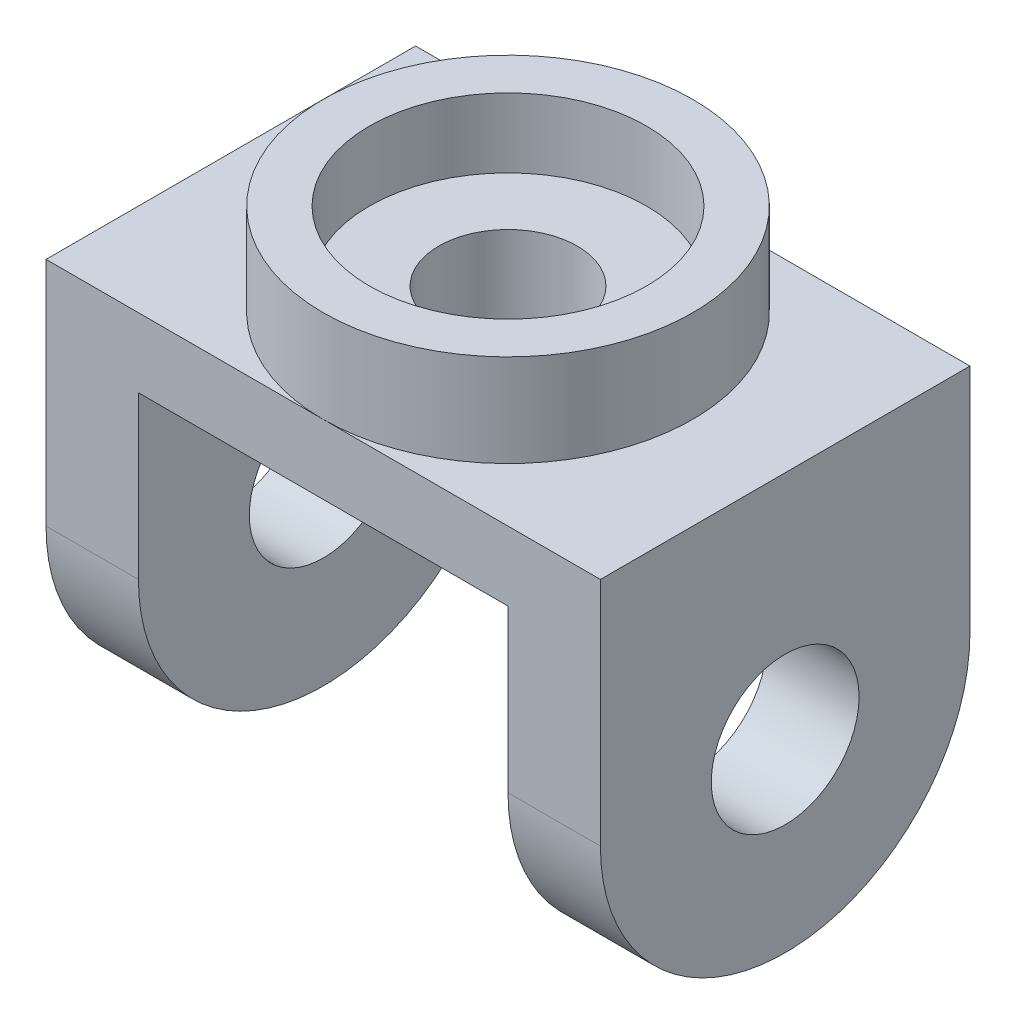
from build123d import *

# Parameters (mm, degrees)
SKETCH1_W           = 120
SKETCH1_H           = 80
BOSS_EXTRUDE1_DEPTH = 15
SKETCH2_R           = 40
BOSS_EXTRUDE2_DEPTH = 20
SKETCH4_R           = 30
CUT_EXTRUDE1_DEPTH  = 15
SKETCH5_R           = 15
CUT_EXTRUDE2_DEPTH  = 42
SKETCH7_W           = 80
SKETCH7_H           = 35
BOSS_EXTRUDE3_DEPTH = 20
BOSS_EXTRUDE4_START = -20
SKETCH8_W           = 80
SKETCH8_H           = 35
BOSS_EXTRUDE4_DEPTH = 20
SKETCH9_R           = 16
CUT_EXTRUDE3_DEPTH  = 139


with BuildPart() as part:
    # Sketch1 → Boss-Extrude1 (new body)
    with BuildSketch(Plane(origin=(0, 0, 0), x_dir=(1, 0, 0), z_dir=(0, 1, 0))):
        Rectangle(SKETCH1_W, SKETCH1_H)
    extrude(amount=-BOSS_EXTRUDE1_DEPTH)

    # Sketch2 → Boss-Extrude2 (add)
    with BuildSketch(Plane(origin=(0, 0, 0), x_dir=(1, 0, 0), z_dir=(0, 1, 0))):
        with Locations(Location((0, 0, 0), (0, 0, 270))):
            Circle(SKETCH2_R)
    extrude(amount=BOSS_EXTRUDE2_DEPTH)

    # Sketch4 → Cut-Extrude1 (cut)
    with BuildSketch(Plane(origin=(0, 20, 0), x_dir=(1, 0, 0), z_dir=(0, 1, 0))):
        with Locations(Location((0, 0, 0), (0, 0, 270))):
            Circle(SKETCH4_R)
    extrude(amount=-CUT_EXTRUDE1_DEPTH, mode=Mode.SUBTRACT)

    # Sketch5 → Cut-Extrude2 (cut)
    with BuildSketch(Plane(origin=(0, 5, 0), x_dir=(1, 0, 0), z_dir=(0, 1, 0))):
        with Locations(Location((0, 0, 0), (0, 0, 270))):
            Circle(SKETCH5_R)
    extrude(amount=-CUT_EXTRUDE2_DEPTH, mode=Mode.SUBTRACT)

    # Sketch7 → Boss-Extrude3 (add)
    with BuildSketch(Plane(origin=(60, 0, 0), x_dir=(0, 0, -1), z_dir=(1, 0, 0))):
        with BuildLine():
            Line((-40, -50), (40, -50))
            ThreePointArc((40, -50), (0, -90), (-40, -50))
        make_face()
        with Locations((0, -32.5)):
            Rectangle(SKETCH7_W, SKETCH7_H)
    extrude(amount=-BOSS_EXTRUDE3_DEPTH)

    # Sketch8 → Boss-Extrude4 (add)
    with BuildSketch(Plane.ZY.offset(60).offset(BOSS_EXTRUDE4_START)):
        with BuildLine():
            Line((-40, -50), (40, -50))
            ThreePointArc((40, -50), (0, -90), (-40, -50))
        make_face()
        with Locations((0, -32.5)):
            Rectangle(SKETCH8_W, SKETCH8_H)
    extrude(amount=BOSS_EXTRUDE4_DEPTH)

    # Sketch9 → Cut-Extrude3 (cut)
    with BuildSketch(Plane.ZY.offset(60)):
        with Locations((0, -50)):
            Circle(SKETCH9_R)
    extrude(amount=-CUT_EXTRUDE3_DEPTH, mode=Mode.SUBTRACT)


solid = part.part
